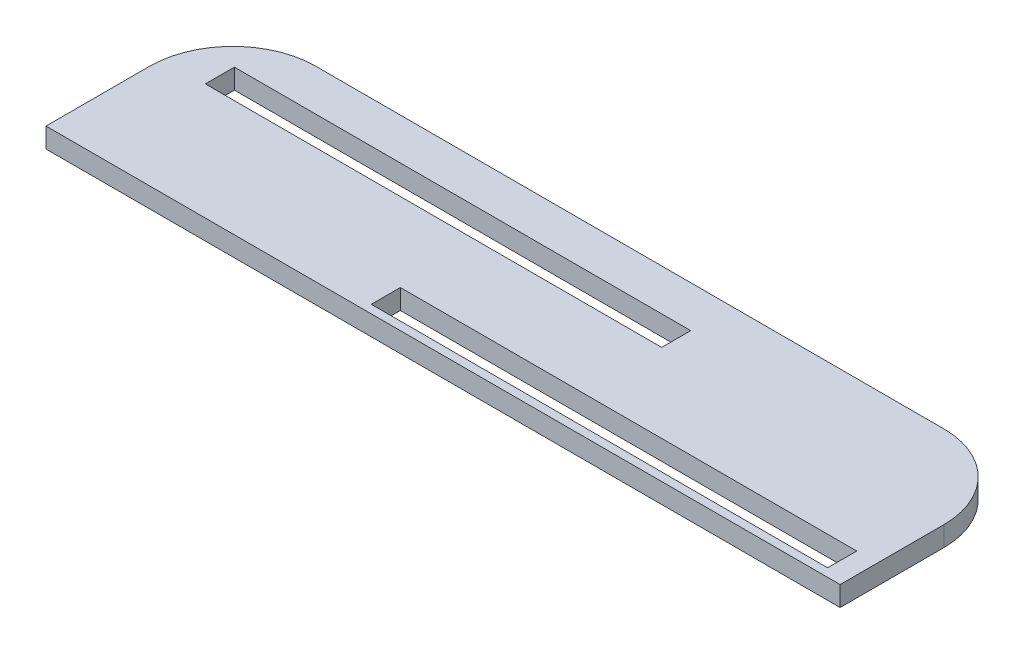
from build123d import *

# Parameters (mm, degrees)
SKETCH1_W           = 9.57
SKETCH1_H           = 2.25
SKETCH1_W_2         = 5.5
SKETCH1_H_2         = 0.35
BOSS_EXTRUDE1_DEPTH = 0.24
FILLET1_R           = 1


with BuildPart() as part:
    # Sketch1 → Boss-Extrude1 (new body)
    with BuildSketch(Plane(origin=(0, 0, 0), x_dir=(1, 0, 0), z_dir=(0, 1, 0))):
        with Locations((4.785, 1.125)):
            Rectangle(SKETCH1_W, SKETCH1_H)
        with Locations((3.27, 1.575)):
            Rectangle(SKETCH1_W_2, SKETCH1_H_2, mode=Mode.SUBTRACT)
        with Locations((6.57, 0.275)):
            Rectangle(SKETCH1_W_2, SKETCH1_H_2, mode=Mode.SUBTRACT)
    extrude(amount=BOSS_EXTRUDE1_DEPTH)

    # Fillet1
    fillet1_edges = [part.edges().sort_by_distance(p)[0] for p in [
        (0, 0.12, -2.25),
        (9.57, 0.12, -2.25),
    ]]
    fillet(fillet1_edges, radius=FILLET1_R)


solid = part.part
